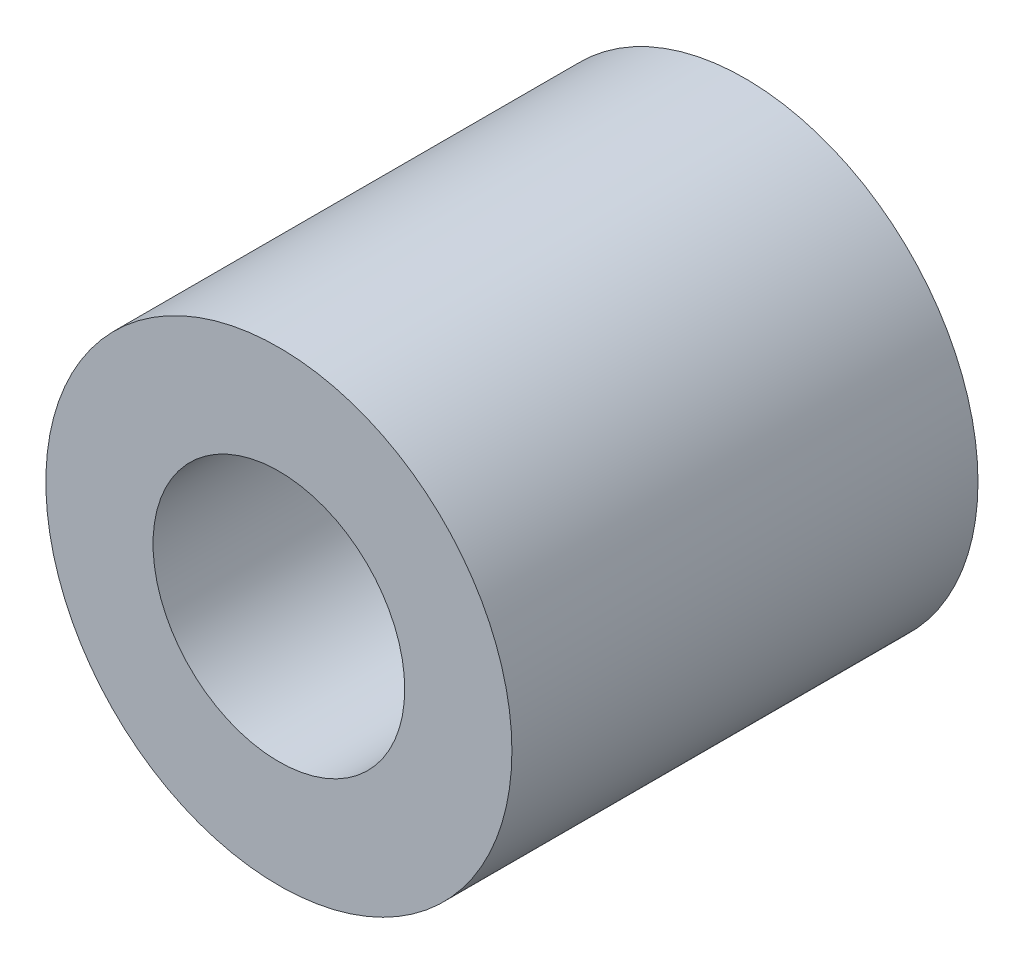
from build123d import *

# Parameters (mm, degrees)
SKETCH_1_R      = 2.5
SKETCH_1_R_2    = 1.35
EXTRUDE_1_DEPTH = 5


with BuildPart() as part:
    # ｽｹｯﾁ1 → ﾎﾞｽ - 押し出し1 (new body)
    with BuildSketch(Plane.XY):
        Circle(SKETCH_1_R)
        Circle(SKETCH_1_R_2, mode=Mode.SUBTRACT)
    extrude(amount=EXTRUDE_1_DEPTH)


solid = part.part
